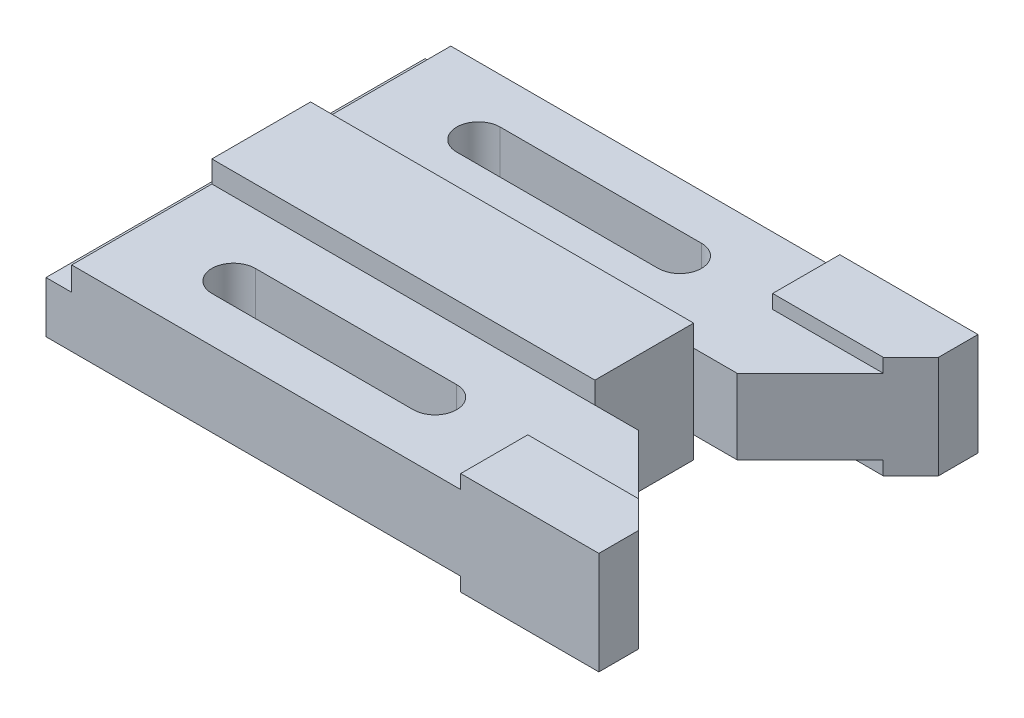
from build123d import *

# Parameters (mm, degrees)
BOSS_EXTRUDE1_DEPTH = 30
CUT_EXTRUDE1_DEPTH  = 2
CUT_EXTRUDE2_DEPTH  = 2
SKETCH5_W           = 6.5
SKETCH5_H           = 96
CUT_EXTRUDE3_DEPTH  = 11.5
CUT_EXTRUDE4_DEPTH  = 5.5
CUT_EXTRUDE5_DEPTH  = 5.5
SKETCH8_W           = 25
SKETCH8_H           = 30
CUT_EXTRUDE6_DEPTH  = 1
SKETCH9_W           = 25
SKETCH9_H           = 30
CUT_EXTRUDE7_DEPTH  = 0.5


with BuildPart() as part:
    # Sketch2 → Boss-Extrude1 (new body)
    # profile 1 of 3: a face of its own
    with BuildSketch(Plane(origin=(0, 0, 0), x_dir=(1, 0, 0), z_dir=(0, 1, 0))):
        Polygon((114.5, 12.5), (133, 31), (98, 31), (98, 48), (0, 48), (0, -48), (98, -48), (98, -31), (133, -31), (114.5, -12.5), (105, -12.5), (105, 12.5), align=None)
        with BuildLine():
            Line((81.5, -36.5), (30.5, -36.5))
            ThreePointArc((30.5, -36.5), (25, -31), (30.5, -25.5))
            Line((30.5, -25.5), (81.5, -25.5))
            ThreePointArc((81.5, -25.5), (87, -31), (81.5, -36.5))
        make_face(mode=Mode.SUBTRACT)
        with BuildLine():
            ThreePointArc((30.5, 25.5), (25, 31), (30.5, 36.5))
            Line((30.5, 36.5), (81.5, 36.5))
            ThreePointArc((81.5, 36.5), (87, 31), (81.5, 25.5))
            Line((81.5, 25.5), (30.5, 25.5))
        make_face(mode=Mode.SUBTRACT)
    # profile 2 of 3: a face of its own
    with BuildSketch(Plane(origin=(0, 0, 0), x_dir=(1, 0, 0), z_dir=(0, 1, 0))):
        Polygon((133, 31), (140, 38), (140, 48), (98, 48), (98, 31), align=None)
    # profile 3 of 3: a face of its own
    with BuildSketch(Plane(origin=(0, 0, 0), x_dir=(1, 0, 0), z_dir=(0, 1, 0))):
        Polygon((98, -31), (98, -48), (140, -48), (140, -38), (133, -31), align=None)
    extrude(amount=BOSS_EXTRUDE1_DEPTH)

    # Sketch3 → Cut-Extrude1 (cut)
    with BuildSketch(Plane(origin=(0, 30, 0), x_dir=(1, 0, 0), z_dir=(0, 1, 0))):
        Polygon((105, 48), (105, 31), (133, 31), (140, 38), (140, 48), align=None)
        Polygon((140, -38), (140, -48), (105, -48), (105, -31), (133, -31), align=None)
    extrude(amount=-CUT_EXTRUDE1_DEPTH, mode=Mode.SUBTRACT)

    # Sketch4 → Cut-Extrude2 (cut)
    with BuildSketch(Plane.XZ):
        Polygon((105, 48), (105, 31), (133, 31), (140, 38), (140, 48), align=None)
        Polygon((105, -48), (105, -31), (133, -31), (140, -38), (140, -48), align=None)
    extrude(amount=-CUT_EXTRUDE2_DEPTH, mode=Mode.SUBTRACT)

    # Sketch5 → Cut-Extrude3 (cut)
    with BuildSketch(Plane(origin=(0, 30, 0), x_dir=(1, 0, 0), z_dir=(0, 1, 0))):
        with Locations((3.25, 0)):
            Rectangle(SKETCH5_W, SKETCH5_H)
    extrude(amount=-CUT_EXTRUDE3_DEPTH, mode=Mode.SUBTRACT)

    # Sketch6 → Cut-Extrude4 (cut)
    with BuildSketch(Plane(origin=(0, 30, 0), x_dir=(1, 0, 0), z_dir=(0, 1, 0))):
        Polygon((105, 12.5), (6.5, 12.5), (6.5, 48), (105, 48), (105, 31), (133, 31), (114.5, 12.5), align=None)
        Polygon((105, -12.5), (6.5, -12.5), (6.5, -48), (105, -48), (105, -31), (133, -31), (114.5, -12.5), align=None)
    extrude(amount=-CUT_EXTRUDE4_DEPTH, mode=Mode.SUBTRACT)

    # Sketch7 → Cut-Extrude5 (cut)
    with BuildSketch(Plane.XZ):
        Polygon((105, 12.5), (6.5, 12.5), (6.5, -12.5), (105, -12.5), (114.5, -12.5), (133, -31), (105, -31), (105, -48), (0, -48), (0, 48), (105, 48), (105, 31), (133, 31), (114.5, 12.5), align=None)
    extrude(amount=-CUT_EXTRUDE5_DEPTH, mode=Mode.SUBTRACT)

    # Sketch8 → Cut-Extrude6 (cut)
    with BuildSketch(Plane(origin=(105, 0, 0), x_dir=(0, 0, -1), z_dir=(1, 0, 0))):
        with Locations((0, 15)):
            Rectangle(SKETCH8_W, SKETCH8_H)
    extrude(amount=-CUT_EXTRUDE6_DEPTH, mode=Mode.SUBTRACT)

    # Sketch9 → Cut-Extrude7 (cut)
    with BuildSketch(Plane(origin=(104, 0, 0), x_dir=(0, 0, -1), z_dir=(1, 0, 0))):
        with Locations((0, 15)):
            Rectangle(SKETCH9_W, SKETCH9_H)
    extrude(amount=-CUT_EXTRUDE7_DEPTH, mode=Mode.SUBTRACT)


solid = part.part
